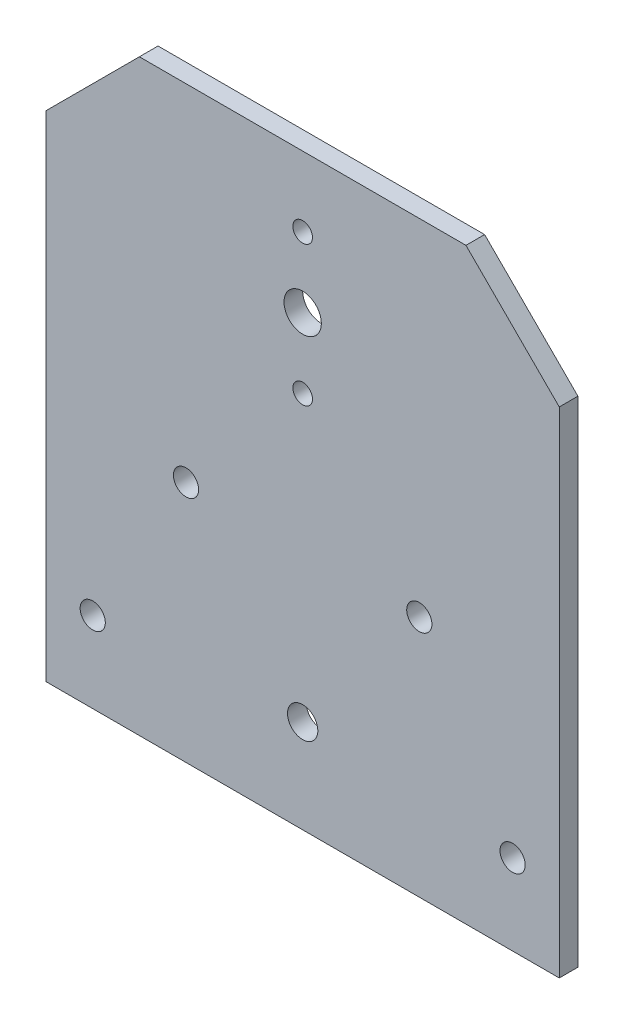
from build123d import *

# Parameters (mm, degrees)
SKETCH_1_W          = 110
SKETCH_1_H          = 126
EXTRUDE_1_DEPTH     = 4
SKETCH_2_R          = 2.7
SKETCH_2_R_2        = 3.25
SKETCH_2_R_3        = 4
SKETCH_2_R_4        = 2.1
CUT_EXTRUDE_2_DEPTH = 4
CUT_EXTRUDE_3_DEPTH = 4


with BuildPart() as part:
    # 草图1 → 凸台-拉伸1 (new body)
    with BuildSketch(Plane.XY):
        with Locations((-12.266115935, -37.027805236)):
            Rectangle(SKETCH_1_W, SKETCH_1_H)
    extrude(amount=EXTRUDE_1_DEPTH)

    # 草图2 → 切除-拉伸2 (cut)
    with BuildSketch(Plane.XY.offset(4)):
        with Locations((12.733884065, -48.027805236)):
            Circle(SKETCH_2_R)
        with Locations((32.733884065, -82.727805236)):
            Circle(SKETCH_2_R)
        with Locations((-37.266115935, -48.027805236)):
            Circle(SKETCH_2_R)
        with Locations((-57.266115935, -82.727805236)):
            Circle(SKETCH_2_R)
        with Locations((-12.266115935, -80.027805236)):
            Circle(SKETCH_2_R_2)
        with Locations((-12.266115935, -4.027805236)):
            Circle(SKETCH_2_R_3)
        with Locations((-12.266115935, 10.972194764)):
            Circle(SKETCH_2_R_4)
        with Locations((-12.266115935, -19.027805236)):
            Circle(SKETCH_2_R_4)
    extrude(amount=-CUT_EXTRUDE_2_DEPTH, mode=Mode.SUBTRACT)

    # 草图3 → 切除-拉伸3 (cut)
    with BuildSketch(Plane.XY.offset(4)):
        Polygon((-67.266115935, 5.972194764), (-47.266115935, 25.972194764), (-67.266115935, 25.972194764), align=None)
        Polygon((22.733884065, 25.972194764), (42.733884065, 5.972194764), (42.733884065, 25.972194764), align=None)
    extrude(amount=-CUT_EXTRUDE_3_DEPTH, mode=Mode.SUBTRACT)


solid = part.part
